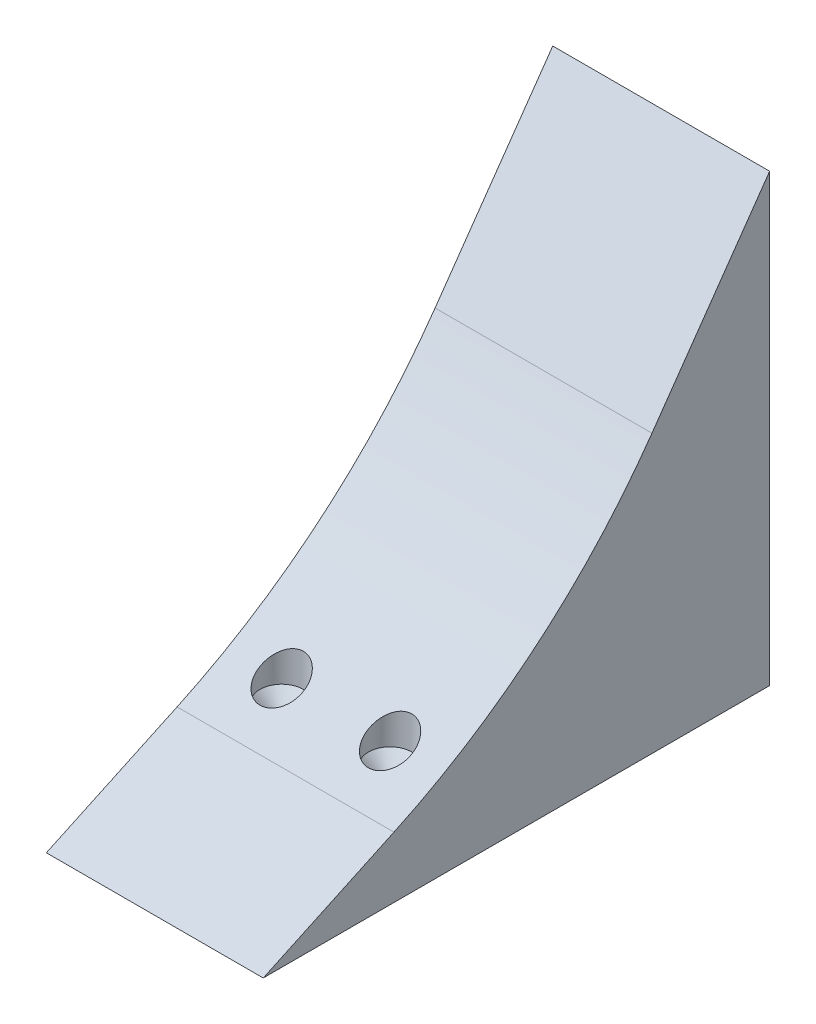
from build123d import *

# Parameters (mm, degrees)
BOSS_EXTRUDE1_DEPTH = 50.8
SKETCH2_R           = 1.905
CUT_EXTRUDE1_DEPTH  = 101.6
CUT_EXTRUDE2_START  = -12.7
SKETCH3_R           = 5.08
CUT_EXTRUDE2_DEPTH  = 101.6
CHAMFER1_SIZE       = 3.048


with BuildPart() as part:
    # Sketch1 → Boss-Extrude1 (new body)
    with BuildSketch(Plane(origin=(0, 0, 0), x_dir=(0, 0, -1), z_dir=(1, 0, 0))):
        with BuildLine():
            Line((-61.489643294, -124.315200567), (57.124090119, -124.315200567))
            Line((57.124090119, -124.315200567), (57.124090119, -19.966735992))
            Line((57.124090119, -19.966735992), (29.562861669, -59.328249467))
            ThreePointArc((29.562861669, -59.328249467), (2.684921835, -88.660373698), (-30.868886791, -110.036507311))
            Line((-30.868886791, -110.036507311), (-61.489643294, -124.315200567))
        make_face()
    extrude(amount=BOSS_EXTRUDE1_DEPTH)

    # Sketch2 → Cut-Extrude1 (cut)
    with BuildSketch(Plane.XZ.offset(124.315200567)):
        with Locations(Location((12.7, 19.075909881, 0), (0, 0, 270))):
            Circle(SKETCH2_R)
        with Locations(Location((38.1, 19.075909881, 0), (0, 0, 270))):
            Circle(SKETCH2_R)
    extrude(amount=-CUT_EXTRUDE1_DEPTH, mode=Mode.SUBTRACT)

    # Sketch3 → Cut-Extrude2 (cut)
    with BuildSketch(Plane.XZ.offset(124.315200567).offset(CUT_EXTRUDE2_START)):
        with Locations(Location((12.7, 19.075909881, 0), (0, 0, 270))):
            Circle(SKETCH3_R)
        with Locations(Location((38.1, 19.075909881, 0), (0, 0, 270))):
            Circle(SKETCH3_R)
    extrude(amount=-CUT_EXTRUDE2_DEPTH, mode=Mode.SUBTRACT)

    # Chamfer1
    chamfer1_edges = [part.edges().sort_by_distance(p)[0] for p in [
        (12.7, -111.615200567, 24.155909881),
        (38.1, -111.615200567, 24.155909881),
    ]]
    chamfer(chamfer1_edges, length=CHAMFER1_SIZE)


solid = part.part
